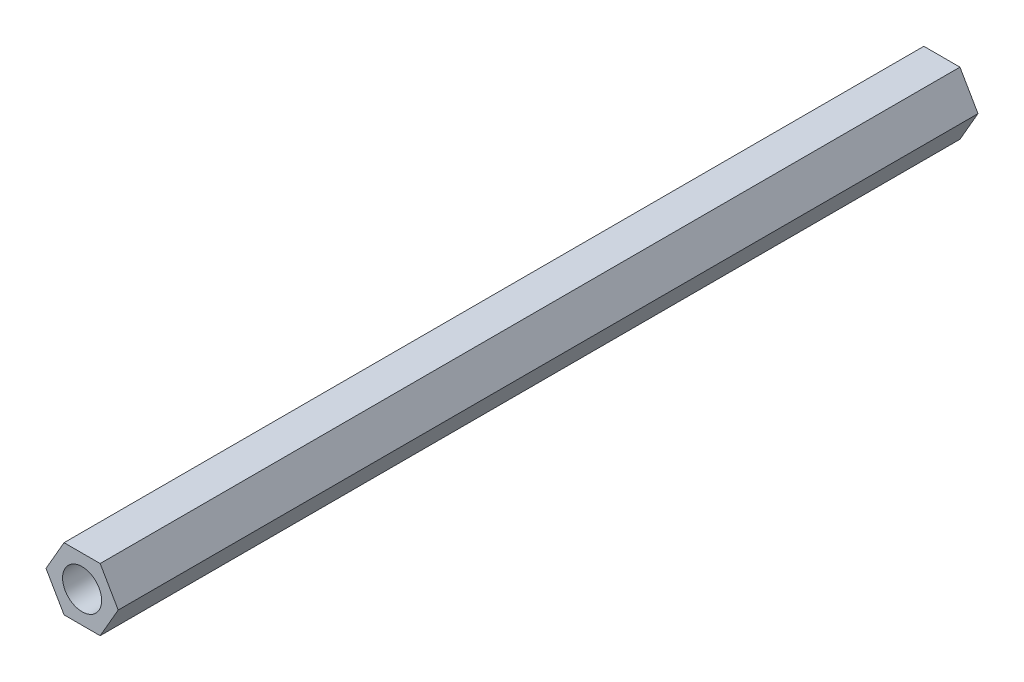
from build123d import *

# Parameters (mm, degrees)
BOSS_EXTRUDE1_DEPTH     = 55
CUT_EXTRUDE1_DEPTH      = 56.084783138
CUT_EXTRUDE1_DEPTH_BACK = 56.084783138
SKETCH2_R               = 1.25


with BuildPart() as part:
    # Sketch1 → Boss-Extrude1 (new body)
    with BuildSketch(Plane.XY):
        Polygon((2.309401077, 0), (1.154700538, 2), (-1.154700538, 2), (-2.309401077, 0), (-1.154700538, -2), (1.154700538, -2), align=None)
    extrude(amount=-BOSS_EXTRUDE1_DEPTH)

    # Sketch2 → Cut-Extrude1 (cut, two sides: drawn at the far end of the back side and taken through both)
    with BuildSketch(Plane.XY.offset(-CUT_EXTRUDE1_DEPTH_BACK)):
        Circle(SKETCH2_R)
    extrude(amount=CUT_EXTRUDE1_DEPTH + CUT_EXTRUDE1_DEPTH_BACK, mode=Mode.SUBTRACT)


solid = part.part
